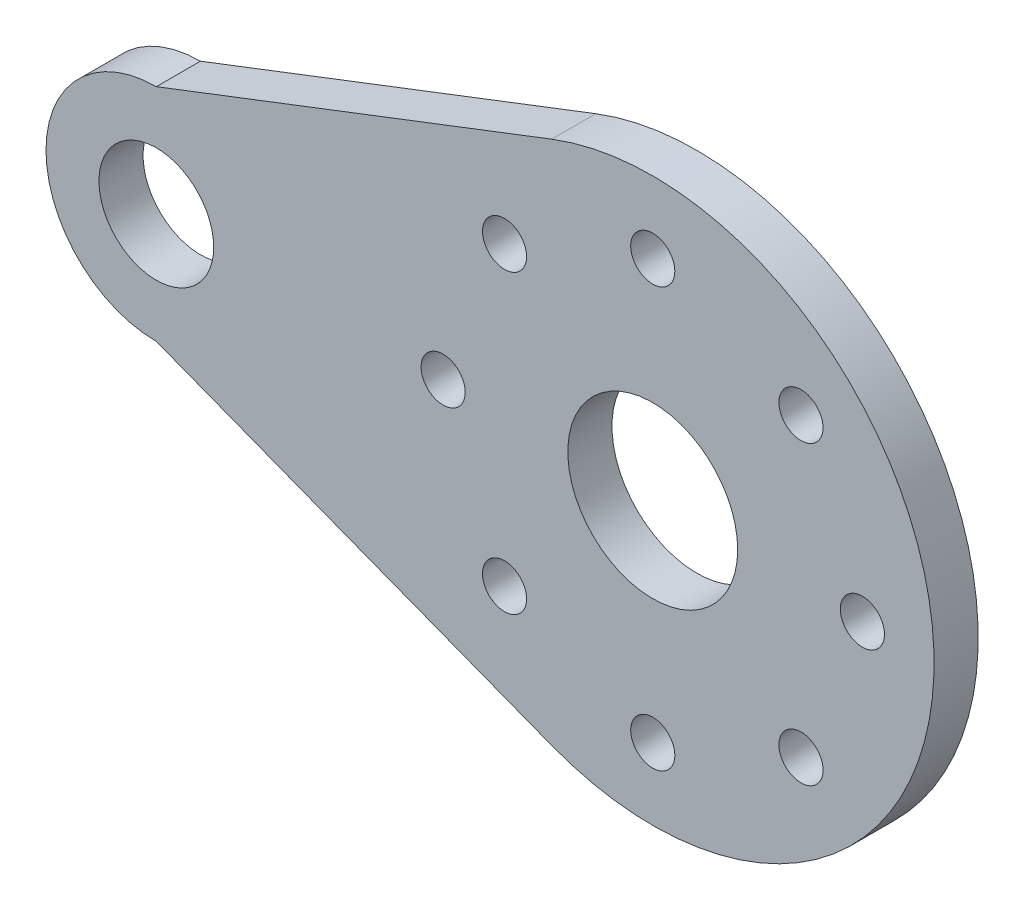
from build123d import *

# Parameters (mm, degrees)
SKETCH_1_R      = 7.7
SKETCH_1_R_2    = 2
SKETCH_1_R_3    = 5.2
EXTRUDE_1_DEPTH = 4


with BuildPart() as part:
    # 草图1 → 凸台-拉伸1 (new body)
    with BuildSketch(Plane.XY):
        with BuildLine():
            Line((95.464772606, -26.638271318), (131.303069471, -40.435607212))
            ThreePointArc((131.303069471, -40.435607212), (165.964772606, -16.638271318), (131.303069471, 7.159064577))
            Line((131.303069471, 7.159064577), (95.464772606, -6.638271318))
            ThreePointArc((95.464772606, -6.638271318), (85.464772606, -16.638271318), (95.464772606, -26.638271318))
        make_face()
        with Locations((140.464772606, -16.638271318)):
            Circle(SKETCH_1_R, mode=Mode.SUBTRACT)
        with Locations((140.464772606, -35.638271318)):
            Circle(SKETCH_1_R_2, mode=Mode.SUBTRACT)
        with Locations((127.029743763, -30.07330016)):
            Circle(SKETCH_1_R_2, mode=Mode.SUBTRACT)
        with Locations((121.464772606, -16.638271318)):
            Circle(SKETCH_1_R_2, mode=Mode.SUBTRACT)
        with Locations((127.029743763, -3.203242475)):
            Circle(SKETCH_1_R_2, mode=Mode.SUBTRACT)
        with Locations((140.464772606, 2.361728682)):
            Circle(SKETCH_1_R_2, mode=Mode.SUBTRACT)
        with Locations((153.899801448, -3.203242475)):
            Circle(SKETCH_1_R_2, mode=Mode.SUBTRACT)
        with Locations((159.464772606, -16.638271318)):
            Circle(SKETCH_1_R_2, mode=Mode.SUBTRACT)
        with Locations((153.899801448, -30.07330016)):
            Circle(SKETCH_1_R_2, mode=Mode.SUBTRACT)
        with Locations((95.464772606, -16.638271318)):
            Circle(SKETCH_1_R_3, mode=Mode.SUBTRACT)
    extrude(amount=EXTRUDE_1_DEPTH)


solid = part.part
